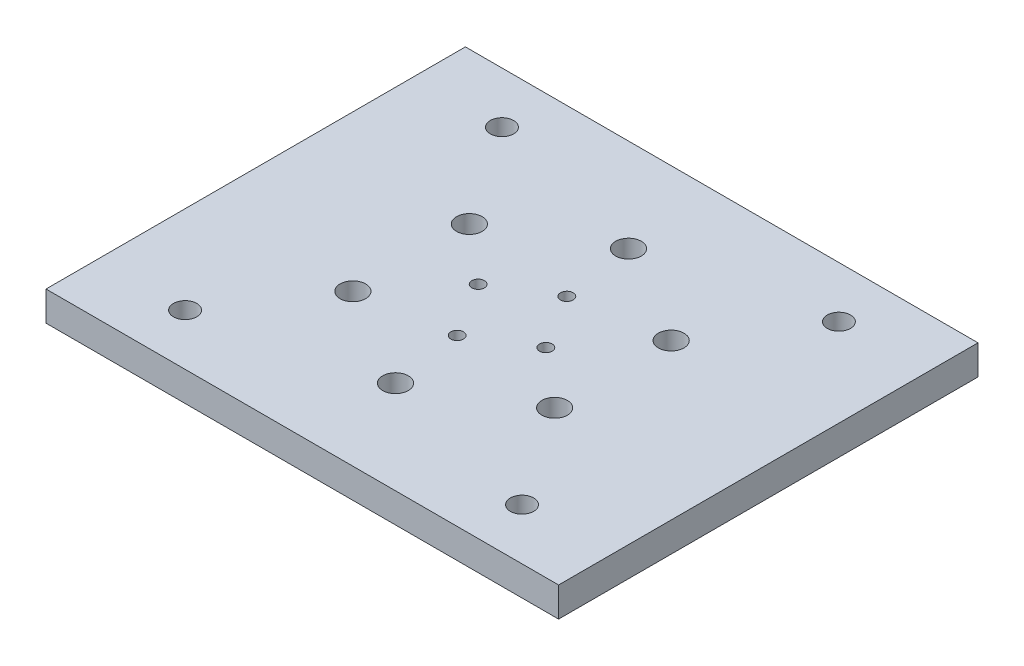
from build123d import *

# Parameters (mm, degrees)
SKETCH2_W            = 110
SKETCH2_H            = 90
BOSS_EXTRUDE1_DEPTH  = 6.35
SKETCH3_R            = 2.5
MOUNTING_HOLES_DEPTH = 143.268487375
CUT_EXTRUDE1_REACH   = 144.268
SKETCH4_R            = 2.75
CUT_EXTRUDE2_REACH   = 144.268
SKETCH5_R            = 1.355


with BuildPart() as part:
    # Sketch2 → Boss-Extrude1 (new body)
    with BuildSketch(Plane(origin=(0, 0, 0), x_dir=(1, 0, 0), z_dir=(0, 1, 0))):
        with Locations((55, 45)):
            Rectangle(SKETCH2_W, SKETCH2_H)
    extrude(amount=BOSS_EXTRUDE1_DEPTH)

    # Sketch3 → Mounting Holes (cut, through all)
    with BuildSketch(Plane(origin=(0, 6.35, 0), x_dir=(1, 0, 0), z_dir=(0, 1, 0))):
        with Locations(Location((18.85, 79, 0), (0, 0, 270))):
            Circle(SKETCH3_R)
        with Locations(Location((18.85, 11, 0), (0, 0, 90))):
            Circle(SKETCH3_R)
        with Locations(Location((91.15, 11, 0), (0, 0, 270))):
            Circle(SKETCH3_R)
        with Locations(Location((91.15, 79, 0), (0, 0, 90))):
            Circle(SKETCH3_R)
    extrude(amount=-MOUNTING_HOLES_DEPTH, mode=Mode.SUBTRACT)

    # Sketch4 → Cut-Extrude1 (cut, up to next)
    with BuildSketch(Plane(origin=(0, 6.35, 0), x_dir=(1, 0, 0), z_dir=(0, 1, 0)), mode=Mode.PRIVATE) as cut_extrude1_sk1:
        with Locations(Location((55, 70, 0), (0, 0, 270))):
            Circle(SKETCH4_R)
    cut_extrude1_tool1 = extrude(cut_extrude1_sk1.sketch, amount=-CUT_EXTRUDE1_REACH, mode=Mode.PRIVATE) & part.part
    # Sketch4 → Cut-Extrude1 (cut, up to next)
    with BuildSketch(Plane(origin=(0, 6.35, 0), x_dir=(1, 0, 0), z_dir=(0, 1, 0)), mode=Mode.PRIVATE) as cut_extrude1_sk2:
        with Locations(Location((76.650635095, 57.5, 0), (0, 0, 270))):
            Circle(SKETCH4_R)
    cut_extrude1_tool2 = extrude(cut_extrude1_sk2.sketch, amount=-CUT_EXTRUDE1_REACH, mode=Mode.PRIVATE) & part.part
    # Sketch4 → Cut-Extrude1 (cut, up to next)
    with BuildSketch(Plane(origin=(0, 6.35, 0), x_dir=(1, 0, 0), z_dir=(0, 1, 0)), mode=Mode.PRIVATE) as cut_extrude1_sk3:
        with Locations(Location((76.650635095, 32.5, 0), (0, 0, 270))):
            Circle(SKETCH4_R)
    cut_extrude1_tool3 = extrude(cut_extrude1_sk3.sketch, amount=-CUT_EXTRUDE1_REACH, mode=Mode.PRIVATE) & part.part
    # Sketch4 → Cut-Extrude1 (cut, up to next)
    with BuildSketch(Plane(origin=(0, 6.35, 0), x_dir=(1, 0, 0), z_dir=(0, 1, 0)), mode=Mode.PRIVATE) as cut_extrude1_sk4:
        with Locations(Location((55, 20, 0), (0, 0, 270))):
            Circle(SKETCH4_R)
    cut_extrude1_tool4 = extrude(cut_extrude1_sk4.sketch, amount=-CUT_EXTRUDE1_REACH, mode=Mode.PRIVATE) & part.part
    # Sketch4 → Cut-Extrude1 (cut, up to next)
    with BuildSketch(Plane(origin=(0, 6.35, 0), x_dir=(1, 0, 0), z_dir=(0, 1, 0)), mode=Mode.PRIVATE) as cut_extrude1_sk5:
        with Locations(Location((33.349364905, 32.5, 0), (0, 0, 270))):
            Circle(SKETCH4_R)
    cut_extrude1_tool5 = extrude(cut_extrude1_sk5.sketch, amount=-CUT_EXTRUDE1_REACH, mode=Mode.PRIVATE) & part.part
    # Sketch4 → Cut-Extrude1 (cut, up to next)
    with BuildSketch(Plane(origin=(0, 6.35, 0), x_dir=(1, 0, 0), z_dir=(0, 1, 0)), mode=Mode.PRIVATE) as cut_extrude1_sk6:
        with Locations(Location((33.349364905, 57.5, 0), (0, 0, 270))):
            Circle(SKETCH4_R)
    cut_extrude1_tool6 = extrude(cut_extrude1_sk6.sketch, amount=-CUT_EXTRUDE1_REACH, mode=Mode.PRIVATE) & part.part
    add(cut_extrude1_tool1.solids().sort_by_distance((55, 6.35, -70))[0], mode=Mode.SUBTRACT)
    add(cut_extrude1_tool2.solids().sort_by_distance((76.650635, 6.35, -57.5))[0], mode=Mode.SUBTRACT)
    add(cut_extrude1_tool3.solids().sort_by_distance((76.650635, 6.35, -32.5))[0], mode=Mode.SUBTRACT)
    add(cut_extrude1_tool4.solids().sort_by_distance((55, 6.35, -20))[0], mode=Mode.SUBTRACT)
    add(cut_extrude1_tool5.solids().sort_by_distance((33.349365, 6.35, -32.5))[0], mode=Mode.SUBTRACT)
    add(cut_extrude1_tool6.solids().sort_by_distance((33.349365, 6.35, -57.5))[0], mode=Mode.SUBTRACT)

    # Sketch5 → Cut-Extrude2 (cut, up to next)
    with BuildSketch(Plane(origin=(0, 6.35, 0), x_dir=(1, 0, 0), z_dir=(0, 1, 0)), mode=Mode.PRIVATE) as cut_extrude2_sk1:
        with Locations(Location((64.516169974, 42.748034189, 0), (0, 0, 270))):
            Circle(SKETCH5_R)
    cut_extrude2_tool1 = extrude(cut_extrude2_sk1.sketch, amount=-CUT_EXTRUDE2_REACH, mode=Mode.PRIVATE) & part.part
    # Sketch5 → Cut-Extrude2 (cut, up to next)
    with BuildSketch(Plane(origin=(0, 6.35, 0), x_dir=(1, 0, 0), z_dir=(0, 1, 0)), mode=Mode.PRIVATE) as cut_extrude2_sk2:
        with Locations(Location((45.483830025, 47.251965809, 0), (0, 0, 270))):
            Circle(SKETCH5_R)
    cut_extrude2_tool2 = extrude(cut_extrude2_sk2.sketch, amount=-CUT_EXTRUDE2_REACH, mode=Mode.PRIVATE) & part.part
    # Sketch5 → Cut-Extrude2 (cut, up to next)
    with BuildSketch(Plane(origin=(0, 6.35, 0), x_dir=(1, 0, 0), z_dir=(0, 1, 0)), mode=Mode.PRIVATE) as cut_extrude2_sk3:
        with Locations(Location((57.251965809, 54.516169974, 0), (0, 0, 270))):
            Circle(SKETCH5_R)
    cut_extrude2_tool3 = extrude(cut_extrude2_sk3.sketch, amount=-CUT_EXTRUDE2_REACH, mode=Mode.PRIVATE) & part.part
    # Sketch5 → Cut-Extrude2 (cut, up to next)
    with BuildSketch(Plane(origin=(0, 6.35, 0), x_dir=(1, 0, 0), z_dir=(0, 1, 0)), mode=Mode.PRIVATE) as cut_extrude2_sk4:
        with Locations(Location((52.74803419, 35.483830024, 0), (0, 0, 270))):
            Circle(SKETCH5_R)
    cut_extrude2_tool4 = extrude(cut_extrude2_sk4.sketch, amount=-CUT_EXTRUDE2_REACH, mode=Mode.PRIVATE) & part.part
    add(cut_extrude2_tool1.solids().sort_by_distance((64.51617, 6.35, -42.748034))[0], mode=Mode.SUBTRACT)
    add(cut_extrude2_tool2.solids().sort_by_distance((45.48383, 6.35, -47.251966))[0], mode=Mode.SUBTRACT)
    add(cut_extrude2_tool3.solids().sort_by_distance((57.251966, 6.35, -54.51617))[0], mode=Mode.SUBTRACT)
    add(cut_extrude2_tool4.solids().sort_by_distance((52.748034, 6.35, -35.48383))[0], mode=Mode.SUBTRACT)


solid = part.part
